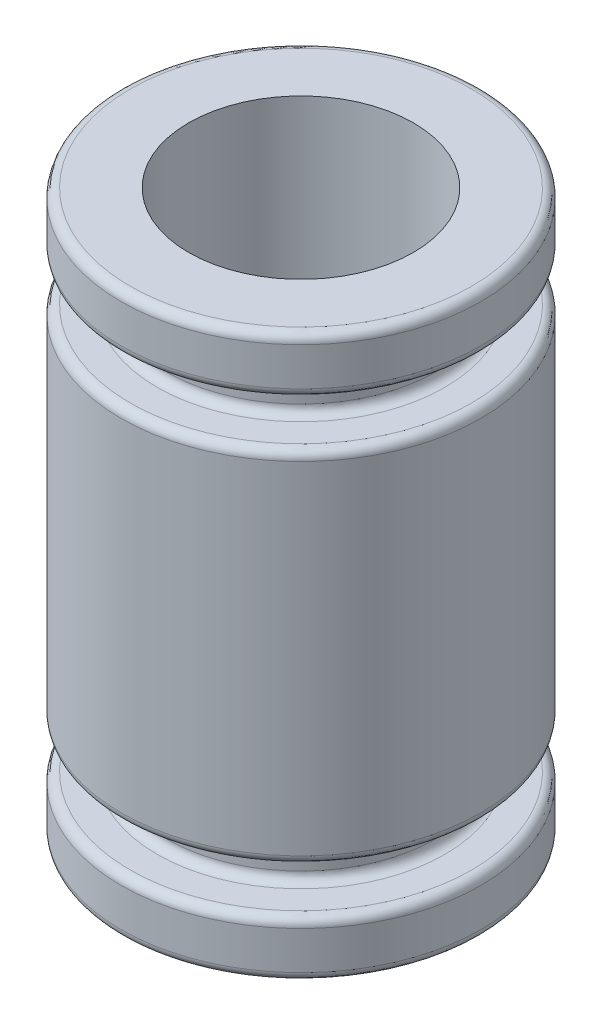
from build123d import *

# Parameters (mm, degrees)
FILLET1_R          = 0.2
SKETCH2_R          = 2.5
CUT_EXTRUDE1_DEPTH = 14.720422792


with BuildPart() as part:
    # Sketch1 → Revolve1 (revolve)
    with BuildSketch(Plane.XY, mode=Mode.PRIVATE) as revolve1_sk:
        Polygon((0, 6.25), (-4, 6.25), (-4, 5), (-3, 5), (-3, 4), (-4, 4), (-4, -4), (-3, -4), (-3, -5), (-4, -5), (-4, -6.25), (0, -6.25), align=None)
    revolve(revolve1_sk.sketch.rotate(Axis((0, -6.25, 0), (0, 1, 0)), 180), axis=Axis((0, -6.25, 0), (0, 1, 0)))

    # Fillet1
    fillet1_edges = [part.edges().sort_by_distance(p)[0] for p in [
        (-3, -4, 0),
        (-4, -4, 0),
        (-4, 4, 0),
        (-3, 4, 0),
        (-3, 5, 0),
        (-4, 5, 0),
        (-4, 6.25, 0),
        (-4, -6.25, 0),
        (-4, -5, 0),
        (-3, -5, 0),
    ]]
    fillet(fillet1_edges, radius=FILLET1_R)

    # Sketch2 → Cut-Extrude1 (cut, through all)
    with BuildSketch(Plane(origin=(0, 6.25, 0), x_dir=(1, 0, 0), z_dir=(0, 1, 0))):
        with Locations(Location((0, 0, 0), (0, 0, 180))):
            Circle(SKETCH2_R)
    extrude(amount=-CUT_EXTRUDE1_DEPTH, mode=Mode.SUBTRACT)


solid = part.part
